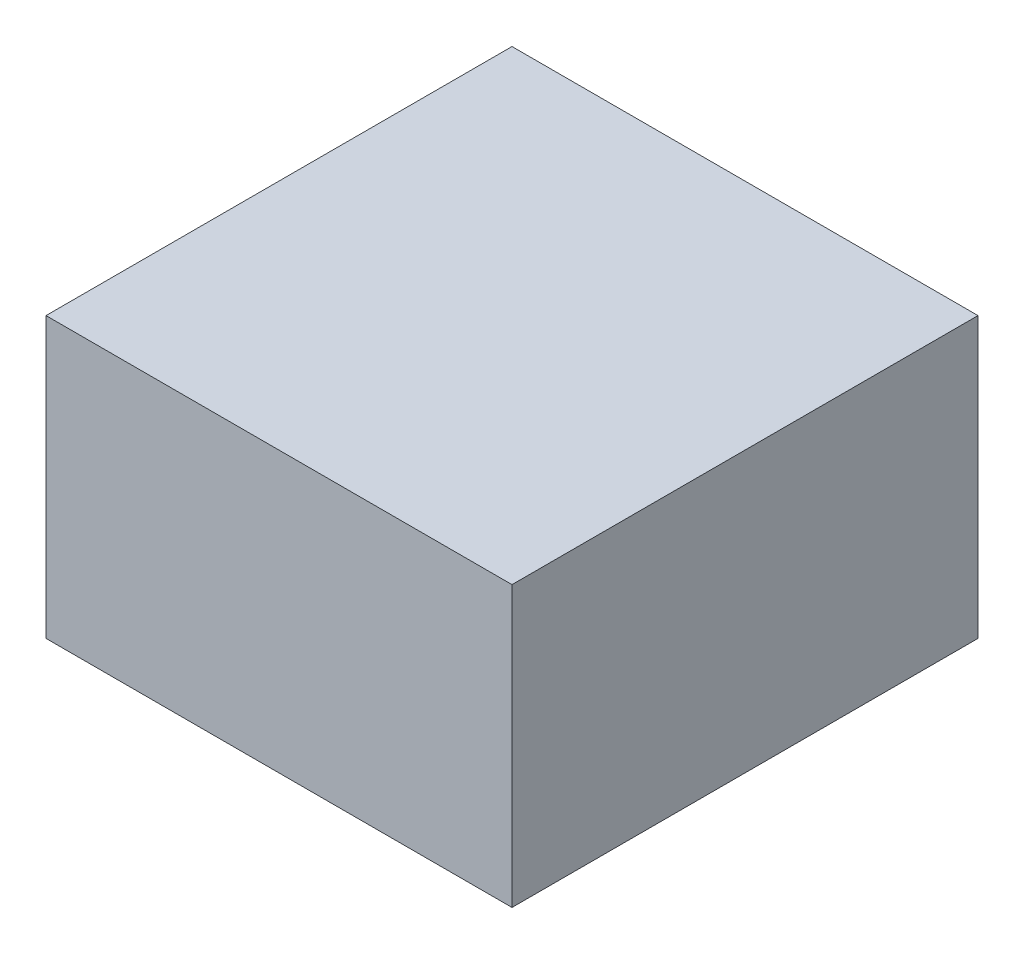
from build123d import *

# Parameters (mm, degrees)
SKETCH1_W           = 5
SKETCH1_H           = 5
BOSS_EXTRUDE1_DEPTH = 3


with BuildPart() as part:
    # Sketch1 → Boss-Extrude1 (new body)
    with BuildSketch(Plane(origin=(0, 0, 0), x_dir=(1, 0, 0), z_dir=(0, 1, 0))):
        with Locations((2.5, -2.5)):
            Rectangle(SKETCH1_W, SKETCH1_H)
    extrude(amount=BOSS_EXTRUDE1_DEPTH)


solid = part.part
